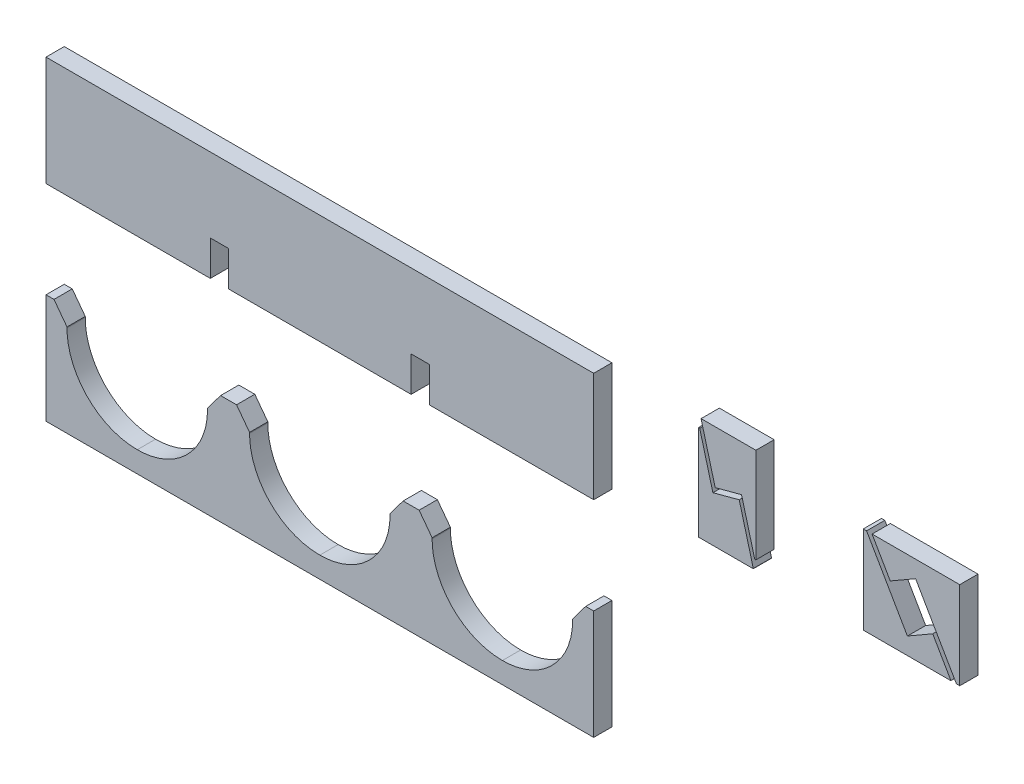
from build123d import *

# Parameters (mm, degrees)
BOSS_EXTRU_1_DEPTH   = 10
BOSS_EXTRU_1_2_DEPTH = 10
BOSS_EXTRU_1_3_DEPTH = 10
BOSS_EXTRU_1_4_DEPTH = 10
BOSS_EXTRU_1_5_DEPTH = 10
BOSS_EXTRU_1_6_DEPTH = 10


with BuildPart() as part:
    # Model → Boss.-Extru.1 (new body)
    with BuildSketch(Plane.XY):
        with BuildLine():
            Line((245.987396918, -237.241344783), (238.857836405, -227.732795114))
            Line((238.857836405, -227.732795114), (230.104537794, -227.732795114))
            Line((230.104537794, -227.732795114), (222.97495575, -237.241366315))
            add(Edge.make_bspline(
                [(222.97495575, -237.241366315), (222.977001275, -237.405180605), (222.981178453, -237.568499663), (222.981178453, -237.732809186)],
                knots=[7, 7, 7, 7, 8, 8, 8, 8], degree=3))
            add(Edge.make_bspline(
                [(222.981178453, -237.732809186), (222.981178453, -258.995766271), (205.744138421, -276.232806304), (184.481181335, -276.232806304)],
                knots=[8, 8, 8, 8, 9, 9, 9, 9], degree=3))
            add(Edge.make_bspline(
                [(184.481181335, -276.232806304), (163.21822425, -276.232806304), (145.981184218, -258.995766271), (145.981184218, -237.732809186)],
                knots=[9, 9, 9, 9, 10, 10, 10, 10], degree=3))
            add(Edge.make_bspline(
                [(145.981184218, -237.732809186), (145.981184218, -237.568499663), (145.985361396, -237.405180605), (145.987406921, -237.241344783)],
                knots=[10, 10, 10, 10, 11, 11, 11, 11], degree=3))
            Line((145.987406921, -237.241344783), (138.857846408, -227.732795114))
            Line((138.857846408, -227.732795114), (130.104547797, -227.732795114))
            Line((130.104547797, -227.732795114), (122.974965752, -237.241366315))
            add(Edge.make_bspline(
                [(122.974965752, -237.241366315), (122.977011278, -237.405180605), (122.981188456, -237.568499663), (122.981188456, -237.732809186)],
                knots=[14, 14, 14, 14, 15, 15, 15, 15], degree=3))
            add(Edge.make_bspline(
                [(122.981188456, -237.732809186), (122.981188456, -258.995766271), (105.744148424, -276.232806304), (84.481191338, -276.232806304)],
                knots=[15, 15, 15, 15, 16, 16, 16, 16], degree=3))
            add(Edge.make_bspline(
                [(84.481191338, -276.232806304), (63.218212721, -276.232806304), (45.981172689, -258.995766271), (45.981172689, -237.732809186)],
                knots=[16, 16, 16, 16, 17, 17, 17, 17], degree=3))
            add(Edge.make_bspline(
                [(45.981172689, -237.732809186), (45.981172689, -237.568478131), (45.985349867, -237.405180605), (45.987395393, -237.241344783)],
                knots=[17, 17, 17, 17, 18, 18, 18, 18], degree=3))
            Line((45.987395393, -237.241344783), (38.85783488, -227.732795114))
            Line((38.85783488, -227.732795114), (34.481185574, -227.732795114))
            Line((34.481185574, -227.732795114), (34.481185574, -287.732793419))
            Line((34.481185574, -287.732793419), (334.481177097, -287.732793419))
            Line((334.481177097, -287.732793419), (334.481177097, -227.732795114))
            Line((334.481177097, -227.732795114), (330.104570855, -227.732795114))
            Line((330.104570855, -227.732795114), (322.974945747, -237.241366315))
            add(Edge.make_bspline(
                [(322.974945747, -237.241366315), (322.977012804, -237.405180605), (322.981189982, -237.568499663), (322.981189982, -237.732809186)],
                knots=[0, 0, 0, 0, 1, 1, 1, 1], degree=3))
            add(Edge.make_bspline(
                [(322.981189982, -237.732809186), (322.981189982, -258.995766271), (305.744128418, -276.232806304), (284.481171332, -276.232806304)],
                knots=[1, 1, 1, 1, 2, 2, 2, 2], degree=3))
            add(Edge.make_bspline(
                [(284.481171332, -276.232806304), (263.218214247, -276.232806304), (245.981174215, -258.995766271), (245.981174215, -237.732809186)],
                knots=[2, 2, 2, 2, 3, 3, 3, 3], degree=3))
            add(Edge.make_bspline(
                [(245.981174215, -237.732809186), (245.981174215, -237.568478131), (245.985351393, -237.405180605), (245.987396918, -237.241344783)],
                knots=[3, 3, 3, 3, 4, 4, 4, 4], degree=3))
        make_face()
    extrude(amount=BOSS_EXTRU_1_DEPTH)


with BuildPart() as body_2:
    # Model → Boss.-Extru.1 2 (new body)
    with BuildSketch(Plane.XY):
        Polygon((414.207509549, -135.116985438), (399.778889826, -138.983136188), (392.546643935, -111.992040369), (391.91360764, -111.992040369), (391.91360764, -163.992031723), (421.91358526, -163.992031723), (421.91358526, -163.876470301), align=None)
    extrude(amount=BOSS_EXTRU_1_2_DEPTH)


with BuildPart() as body_3:
    # Model → Boss.-Extru.1 3 (new body)
    with BuildSketch(Plane.XY):
        Polygon((401.03807516, -135.93039288), (415.466694883, -132.064242129), (422.698940776, -159.055337947), (423.331977072, -159.055337947), (423.331977067, -107.055346593), (393.331999447, -107.055346596), (393.331999447, -107.170908018), align=None)
    extrude(amount=BOSS_EXTRU_1_3_DEPTH)


with BuildPart() as body_4:
    # Model → Boss.-Extru.1 4 (new body)
    with BuildSketch(Plane.XY):
        Polygon((34.481185574, -114.977779473), (34.481185574, -174.977777778), (124.481183031, -174.977777778), (124.481183031, -164.977785238), (124.481183031, -155.776387363), (134.481175571, -155.776387363), (134.481175571, -164.977785238), (134.481175571, -174.977777778), (234.4811871, -174.977777778), (234.4811871, -164.977785238), (234.4811871, -155.776387363), (244.48117964, -155.776387363), (244.48117964, -164.977785238), (244.48117964, -174.977777778), (334.481177097, -174.977777778), (334.481177097, -114.977779473), align=None)
    extrude(amount=BOSS_EXTRU_1_4_DEPTH)


with BuildPart() as body_5:
    # Model → Boss.-Extru.1 5 (new body)
    with BuildSketch(Plane.XY):
        Polygon((520.199535285, -145.693970913), (506.321958584, -153.706186422), (483.96212616, -114.977779473), (482.142857361, -114.977779473), (482.142857361, -162.977778117), (530.142856005, -162.977778117), (530.142856005, -162.916304694), align=None)
    extrude(amount=BOSS_EXTRU_1_5_DEPTH)


with BuildPart() as body_6:
    # Model → Boss.-Extru.1 6 (new body)
    with BuildSketch(Plane.XY):
        Polygon((496.942097239, -132.261586678), (510.819673939, -124.249371168), (533.179506367, -162.977778115), (534.998775166, -162.977778115), (534.998775161, -114.977779471), (486.998776518, -114.977779475), (486.998776518, -115.039252898), align=None)
    extrude(amount=BOSS_EXTRU_1_6_DEPTH)


solid = Compound([part.part, body_2.part, body_3.part, body_4.part, body_5.part, body_6.part])
